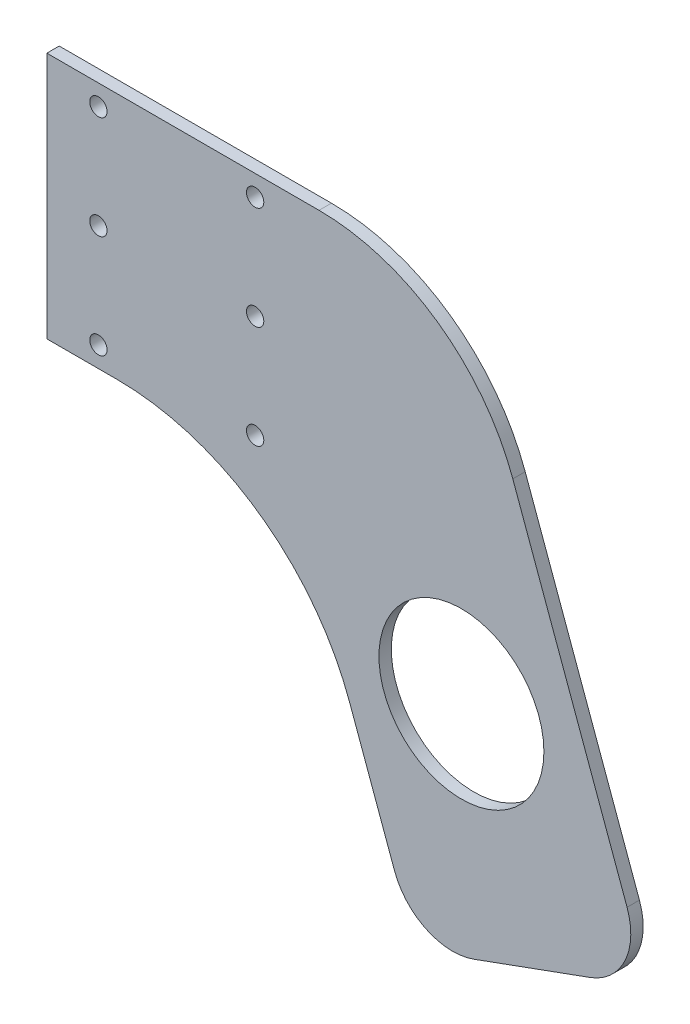
from build123d import *

# Parameters (mm, degrees)
SKETCH1_R           = 20
SKETCH1_R_2         = 2.1
BOSS_EXTRUDE1_DEPTH = 3
FILLET1_R           = 50
FILLET2_R           = 60
FILLET3_R           = 15


with BuildPart() as part:
    # Sketch1 → Boss-Extrude1 (new body)
    with BuildSketch(Plane.XY):
        Polygon((-80, 26.564623636), (-80, 86.564623636), (0, 86.564623636), (21.006226146, 86.564623636), (65.812994389, -36.540960351), (9.431437142, -57.06216895), (-21.006226146, 26.564623636), align=None)
        with Locations((20.5212086, 0.183066389)):
            Circle(SKETCH1_R, mode=Mode.SUBTRACT)
        with Locations((-67.5, 81.564623636)):
            Circle(SKETCH1_R_2, mode=Mode.SUBTRACT)
        with Locations((-67.5, 56.564623636)):
            Circle(SKETCH1_R_2, mode=Mode.SUBTRACT)
        with Locations((-67.5, 31.564623636)):
            Circle(SKETCH1_R_2, mode=Mode.SUBTRACT)
        with Locations((-29.5, 81.564623636)):
            Circle(SKETCH1_R_2, mode=Mode.SUBTRACT)
        with Locations((-29.5, 56.564623636)):
            Circle(SKETCH1_R_2, mode=Mode.SUBTRACT)
        with Locations((-29.5, 31.564623636)):
            Circle(SKETCH1_R_2, mode=Mode.SUBTRACT)
    extrude(amount=BOSS_EXTRUDE1_DEPTH)

    # Fillet1
    fillet1_edges = [part.edges().sort_by_distance(p)[0] for p in [
        (21.006226146, 86.564623636, 1.5),
    ]]
    fillet(fillet1_edges, radius=FILLET1_R)

    # Fillet2
    fillet2_edges = [part.edges().sort_by_distance(p)[0] for p in [
        (-21.006226146, 26.564623636, 1.5),
    ]]
    fillet(fillet2_edges, radius=FILLET2_R)

    # Fillet3
    fillet3_edges = [part.edges().sort_by_distance(p)[0] for p in [
        (65.812994389, -36.540960351, 1.5),
        (9.431437142, -57.06216895, 1.5),
    ]]
    fillet(fillet3_edges, radius=FILLET3_R)


solid = part.part
